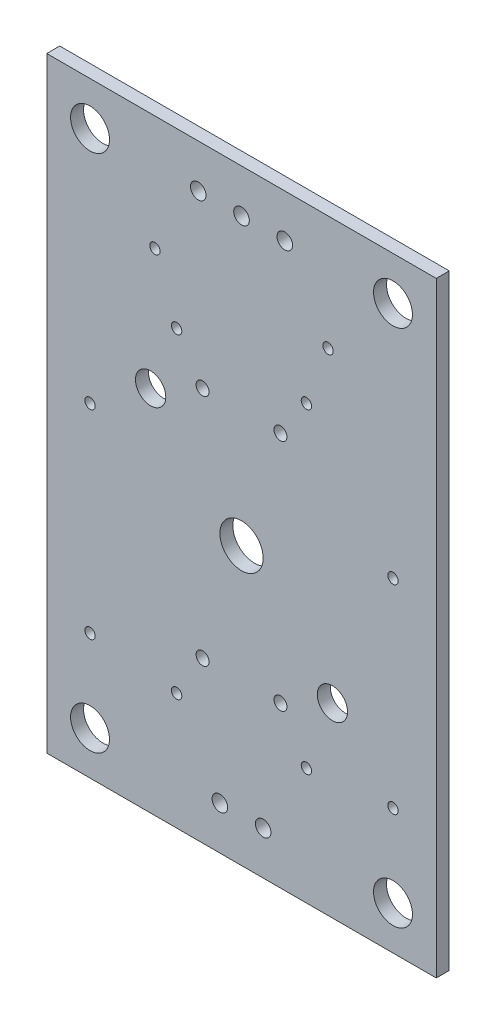
from build123d import *

# Parameters (mm, degrees)
SKETCH_1_W          = 45
SKETCH_1_H          = 70
SKETCH_1_R          = 2.25
SKETCH_1_R_2        = 2.5
SKETCH_1_R_3        = 1.75
SKETCH_1_R_4        = 0.9
SKETCH_1_R_5        = 0.75
EXTRUDE_1_DEPTH     = 1.5
SKETCH_2_R          = 0.6
CUT_EXTRUDE_1_DEPTH = 1.5


with BuildPart() as part:
    # Эскиз1 → Вытянуть1 (new body)
    with BuildSketch(Plane.XY):
        Rectangle(SKETCH_1_W, SKETCH_1_H)
        with Locations((-17.5, 30)):
            Circle(SKETCH_1_R, mode=Mode.SUBTRACT)
        with Locations(Location((17.5, 30, 0), (0, 0, 180))):
            Circle(SKETCH_1_R, mode=Mode.SUBTRACT)
        with Locations((17.5, -30)):
            Circle(SKETCH_1_R, mode=Mode.SUBTRACT)
        with Locations(Location((-17.5, -30, 0), (0, 0, 180))):
            Circle(SKETCH_1_R, mode=Mode.SUBTRACT)
        with Locations((0, -3)):
            Circle(SKETCH_1_R_2, mode=Mode.SUBTRACT)
        with Locations((-10.5, 7.5)):
            Circle(SKETCH_1_R_3, mode=Mode.SUBTRACT)
        with Locations((10.5, -13.5)):
            Circle(SKETCH_1_R_3, mode=Mode.SUBTRACT)
        with Locations((-5, 30)):
            Circle(SKETCH_1_R_4, mode=Mode.SUBTRACT)
        with Locations((0, 30)):
            Circle(SKETCH_1_R_4, mode=Mode.SUBTRACT)
        with Locations((5, 30)):
            Circle(SKETCH_1_R_4, mode=Mode.SUBTRACT)
        with Locations((-2.5, -30)):
            Circle(SKETCH_1_R_4, mode=Mode.SUBTRACT)
        with Locations((2.5, -30)):
            Circle(SKETCH_1_R_4, mode=Mode.SUBTRACT)
        with Locations((-4.5, -16.5)):
            Circle(SKETCH_1_R_5, mode=Mode.SUBTRACT)
        with Locations((-4.5, 10.5)):
            Circle(SKETCH_1_R_5, mode=Mode.SUBTRACT)
        with Locations(Location((4.5, -16.5, 0), (0, 0, 180))):
            Circle(SKETCH_1_R_5, mode=Mode.SUBTRACT)
        with Locations(Location((4.5, 10.5, 0), (0, 0, 180))):
            Circle(SKETCH_1_R_5, mode=Mode.SUBTRACT)
    extrude(amount=EXTRUDE_1_DEPTH)

    # Эскиз2 → Вырез-Вытянуть1 (cut)
    with BuildSketch(Plane.XY.offset(1.5)):
        with Locations((-17.5, -20.5)):
            Circle(SKETCH_2_R)
        with Locations((-17.5, 2.5)):
            Circle(SKETCH_2_R)
        with Locations(Location((17.5, 2.5, 0), (0, 0, 180))):
            Circle(SKETCH_2_R)
        with Locations(Location((17.5, -20.5, 0), (0, 0, 180))):
            Circle(SKETCH_2_R)
        with Locations((-7.5, -21.5)):
            Circle(SKETCH_2_R)
        with Locations((7.5, -21.5)):
            Circle(SKETCH_2_R)
        with Locations((-7.5, 15)):
            Circle(SKETCH_2_R)
        with Locations((7.5, 15)):
            Circle(SKETCH_2_R)
        with Locations((-10, 21.75)):
            Circle(SKETCH_2_R)
        with Locations(Location((10, 21.75, 0), (0, 0, 180))):
            Circle(SKETCH_2_R)
    extrude(amount=-CUT_EXTRUDE_1_DEPTH, mode=Mode.SUBTRACT)


solid = part.part
